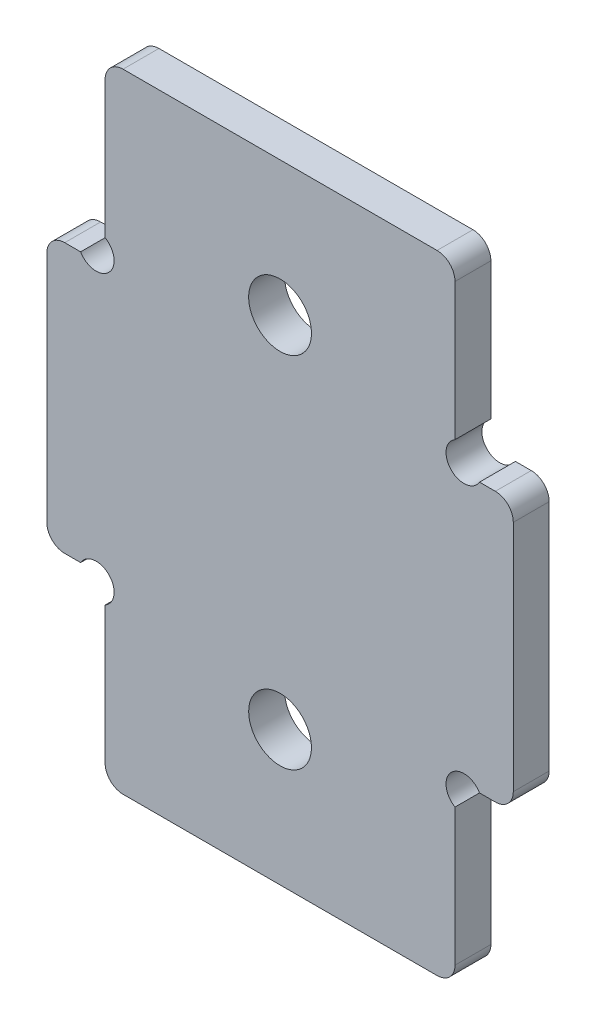
from build123d import *

# Parameters (mm, degrees)
SKETCH_1_W          = 19.5
SKETCH_1_H          = 35
EXTRUDE_1_DEPTH     = 2
SKETCH_3_R          = 1.75
CUT_EXTRUDE_1_DEPTH = 41.115458367
SKETCH_4_W          = 3.25
SKETCH_4_H          = 15
EXTRUDE_2_DEPTH     = 2
SKETCH_5_R          = 1
CUT_EXTRUDE_2_DEPTH = 10
FILLET_1_R          = 1


with BuildPart() as part:
    # 草图1 → 凸台-拉伸1 (new body)
    with BuildSketch(Plane.XY):
        with Locations((9.75, 17.5)):
            Rectangle(SKETCH_1_W, SKETCH_1_H)
    extrude(amount=EXTRUDE_1_DEPTH)

    # 草图3 → 切除-拉伸1 (cut, through all)
    with BuildSketch(Plane.XY.offset(2)):
        with Locations((9.75, 27.5)):
            Circle(SKETCH_3_R)
        with Locations(Location((9.75, 7.5, 0), (0, 0, 180))):
            Circle(SKETCH_3_R)
    extrude(amount=-CUT_EXTRUDE_1_DEPTH, mode=Mode.SUBTRACT)

    # 草图4 → 凸台-拉伸2 (add)
    with BuildSketch(Plane.XY.offset(2)):
        with Locations((21.125, 17.5)):
            Rectangle(SKETCH_4_W, SKETCH_4_H)
        with Locations((-1.625, 17.5)):
            Rectangle(SKETCH_4_W, SKETCH_4_H)
    extrude(amount=-EXTRUDE_2_DEPTH)

    # 草图5 → 切除-拉伸2 (cut)
    with BuildSketch(Plane.XY.offset(2)):
        with Locations((20, 25.5)):
            Circle(SKETCH_5_R)
        with Locations((20, 9.5)):
            Circle(SKETCH_5_R)
        with Locations((-0.5, 9.5)):
            Circle(SKETCH_5_R)
        with Locations((-0.5, 25.5)):
            Circle(SKETCH_5_R)
    extrude(amount=-CUT_EXTRUDE_2_DEPTH, mode=Mode.SUBTRACT)

    # 圆角1
    fillet_1_edges = [part.edges().sort_by_distance(p)[0] for p in [
        (22.75, 10, 1),
        (22.75, 25, 1),
        (-3.25, 10, 1),
        (-3.25, 25, 1),
        (19.5, 35, 1),
        (19.5, 0, 1),
        (0, 0, 1),
        (0, 35, 1),
    ]]
    fillet(fillet_1_edges, radius=FILLET_1_R)


solid = part.part
